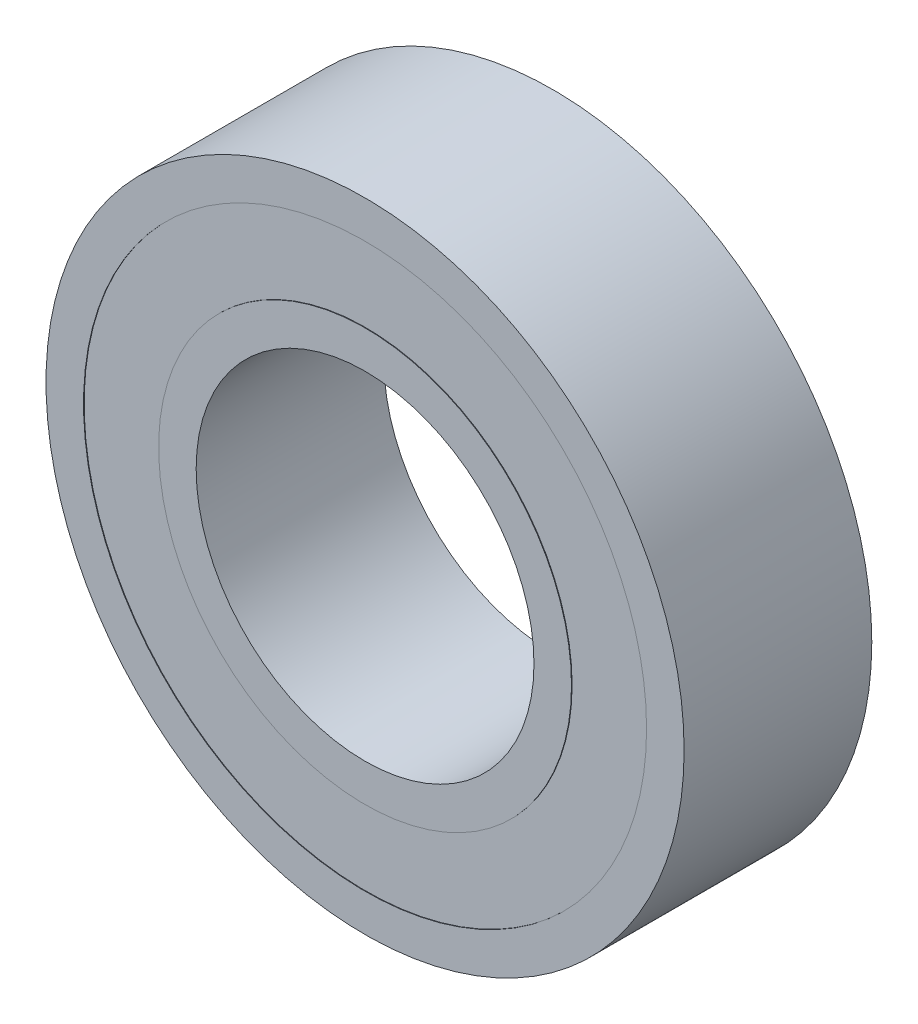
from build123d import *

# Parameters (mm, degrees)
BOSS_EXTRUDE1_DEPTH        = 2.5
BOSS_EXTRUDE1_DEPTH_BACK   = 2.5
SKETCH1_R                  = 5.5
SKETCH1_R_2                = 4.5
BOSS_EXTRUDE1_2_DEPTH      = 2.5
BOSS_EXTRUDE1_2_DEPTH_BACK = 2.5
SKETCH1_R_3                = 8.5
SKETCH1_R_4                = 7.5
BOSS_EXTRUDE2_DEPTH        = 2.484375
BOSS_EXTRUDE2_DEPTH_BACK   = 2.484375
SKETCH1_3_R                = 7.5
SKETCH1_3_R_2              = 5.5


with BuildPart() as part:
    # Sketch1 → Boss-Extrude1 (new, two sides: drawn at the far end of the back side and taken through both)
    with BuildSketch(Plane.XY.offset(-BOSS_EXTRUDE1_DEPTH_BACK)):
        Circle(SKETCH1_R)
        Circle(SKETCH1_R_2, mode=Mode.SUBTRACT)
    extrude(amount=BOSS_EXTRUDE1_DEPTH + BOSS_EXTRUDE1_DEPTH_BACK)



with BuildPart() as body_2:
    # Sketch1 → Boss-Extrude1 2 (new, two sides: drawn at the far end of the back side and taken through both)
    with BuildSketch(Plane.XY.offset(-BOSS_EXTRUDE1_2_DEPTH_BACK)):
        Circle(SKETCH1_R_3)
        Circle(SKETCH1_R_4, mode=Mode.SUBTRACT)
    extrude(amount=BOSS_EXTRUDE1_2_DEPTH + BOSS_EXTRUDE1_2_DEPTH_BACK)


with BuildPart() as part_1:
    add(part.part)

    add(body_2.part)  # Boss-Extrude2 merges body 2
    # Sketch1<3> → Boss-Extrude2 (add, two sides: drawn at the far end of the back side and taken through both)
    with BuildSketch(Plane.XY.offset(-BOSS_EXTRUDE2_DEPTH_BACK)):
        Circle(SKETCH1_3_R)
        Circle(SKETCH1_3_R_2, mode=Mode.SUBTRACT)
    extrude(amount=BOSS_EXTRUDE2_DEPTH + BOSS_EXTRUDE2_DEPTH_BACK)


solid = part_1.part
